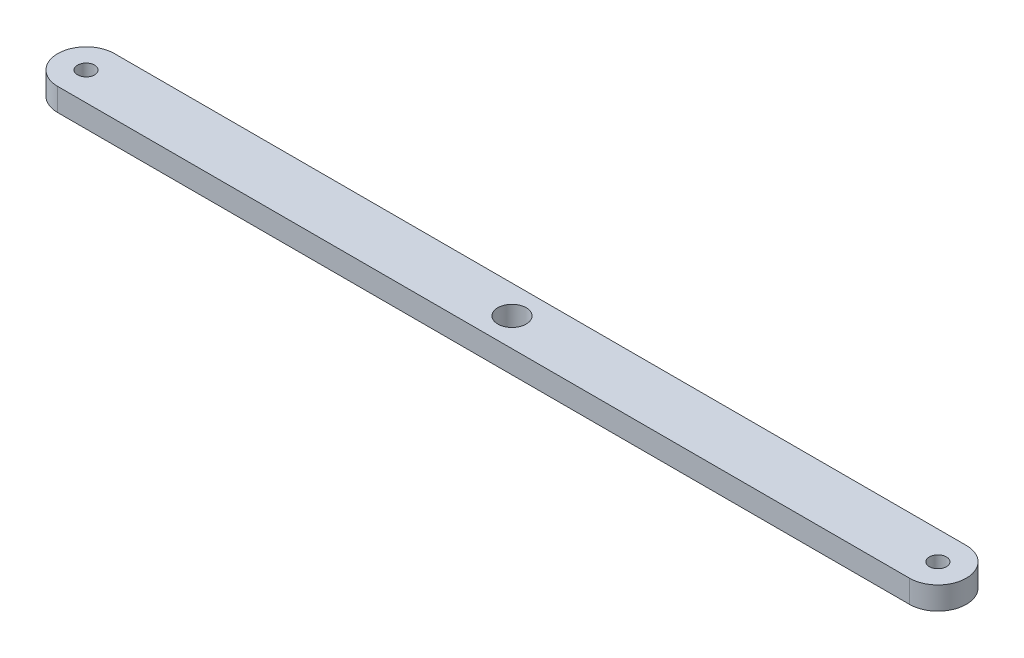
from build123d import *

# Parameters (mm, degrees)
SKETCH_1_R      = 1.5
SKETCH_1_R_2    = 2.5
EXTRUDE_1_DEPTH = 4


with BuildPart() as part:
    # Эскиз1 → Бобышка-Вытянуть1 (new body)
    with BuildSketch(Plane(origin=(0, 0, 0), x_dir=(1, 0, 0), z_dir=(0, 1, 0))):
        with BuildLine():
            Line((75, 5), (-75, 5))
            ThreePointArc((-75, 5), (-80, 0), (-75, -5))
            Line((-75, -5), (75, -5))
            ThreePointArc((75, -5), (80, 0), (75, 5))
        make_face()
        with Locations(Location((-75, 0, 0), (0, 0, 270))):
            Circle(SKETCH_1_R, mode=Mode.SUBTRACT)
        with Locations(Location((0, 0, 0), (0, 0, 270))):
            Circle(SKETCH_1_R_2, mode=Mode.SUBTRACT)
        with Locations(Location((75, 0, 0), (0, 0, 270))):
            Circle(SKETCH_1_R, mode=Mode.SUBTRACT)
    extrude(amount=EXTRUDE_1_DEPTH)


solid = part.part
